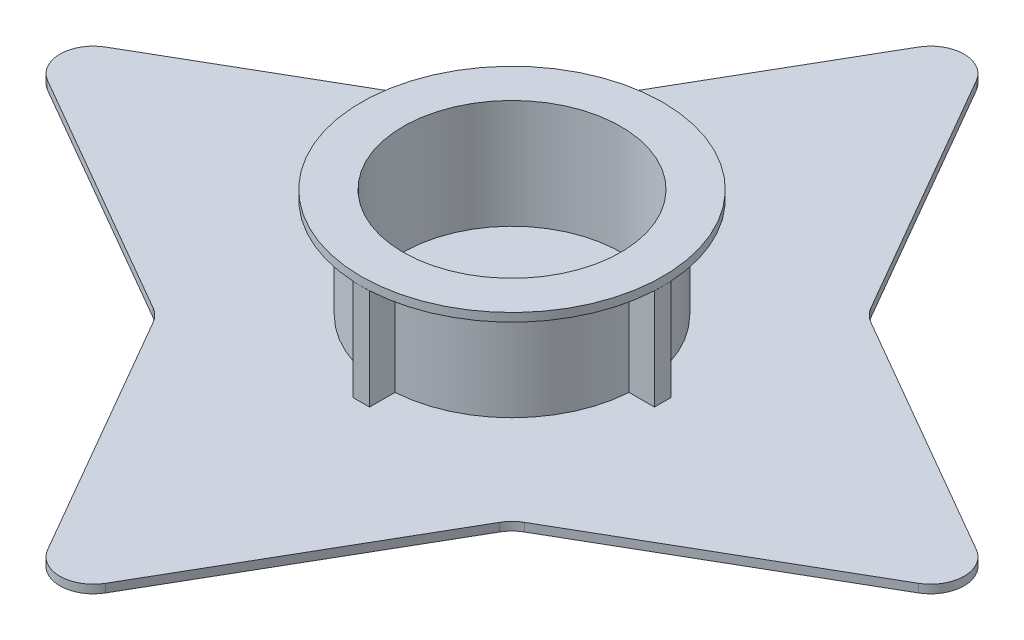
from build123d import *

# Parameters (mm, degrees)
EXTRUIR1_DEPTH = 5
REDONDEO1_R    = 20
EXTRUIR3_DEPTH = 60
CROQUIS4_R     = 90
EXTRUIR4_DEPTH = 5
CROQUIS5_R     = 65
EXTRUIR5_DEPTH = 65


with BuildPart() as part:
    # Croquis1 → Extruir1 (new body)
    with BuildSketch(Plane(origin=(0, 0, 0), x_dir=(1, 0, 0), z_dir=(0, 1, 0))):
        Polygon((106.066017178, 106.066017178), (289.777747887, 0), (106.066017178, -106.066017178), (0, -289.777747887), (-106.066017178, -106.066017178), (-289.777747887, 0), (-106.066017178, 106.066017178), (0, 289.777747887), align=None)
    extrude(amount=EXTRUIR1_DEPTH)

    # Redondeo1
    redondeo1_edges = [part.edges().sort_by_distance(p)[0] for p in [
        (106.066017178, 2.5, -106.066017178),
        (289.777747887, 2.5, 0),
        (106.066017178, 2.5, 106.066017178),
        (0, 2.5, 289.777747887),
        (-106.066017178, 2.5, 106.066017178),
        (-289.777747887, 2.5, 0),
        (-106.066017178, 2.5, -106.066017178),
        (0, 2.5, -289.777747887),
    ]]
    fillet(redondeo1_edges, radius=REDONDEO1_R)

    # Croquis2 → Extruir3 (add)
    with BuildSketch(Plane(origin=(0, 5, 0), x_dir=(1, 0, 0), z_dir=(0, 1, 0))):
        with BuildLine():
            Line((74.833147735, 5), (90, 5))
            Line((90, 5), (90, -5))
            Line((90, -5), (74.833147735, -5))
            ThreePointArc((74.833147735, -5), (53.033008589, -53.033008589), (5, -74.833147735))
            Line((5, -74.833147735), (5, -90))
            Line((5, -90), (-5, -90))
            Line((-5, -90), (-5, -74.833147735))
            ThreePointArc((-5, -74.833147735), (-53.033008589, -53.033008589), (-74.833147735, -5))
            Line((-74.833147735, -5), (-90, -5))
            Line((-90, -5), (-90, 5))
            Line((-90, 5), (-74.833147735, 5))
            ThreePointArc((-74.833147735, 5), (-53.033008589, 53.033008589), (-5, 74.833147735))
            Line((-5, 74.833147735), (-5, 90))
            Line((-5, 90), (5, 90))
            Line((5, 90), (5, 74.833147735))
            ThreePointArc((5, 74.833147735), (53.033008589, 53.033008589), (74.833147735, 5))
        make_face()
    extrude(amount=EXTRUIR3_DEPTH)

    # Croquis4 → Extruir4 (add)
    with BuildSketch(Plane(origin=(0, 65, 0), x_dir=(1, 0, 0), z_dir=(0, 1, 0))):
        with Locations(Location((0, 0, 0), (0, 0, 270))):
            Circle(CROQUIS4_R)
    extrude(amount=EXTRUIR4_DEPTH)

    # Croquis5 → Extruir5 (cut)
    with BuildSketch(Plane(origin=(0, 70, 0), x_dir=(1, 0, 0), z_dir=(0, 1, 0))):
        with Locations(Location((0, 0, 0), (0, 0, 270))):
            Circle(CROQUIS5_R)
    extrude(amount=-EXTRUIR5_DEPTH, mode=Mode.SUBTRACT)


solid = part.part
